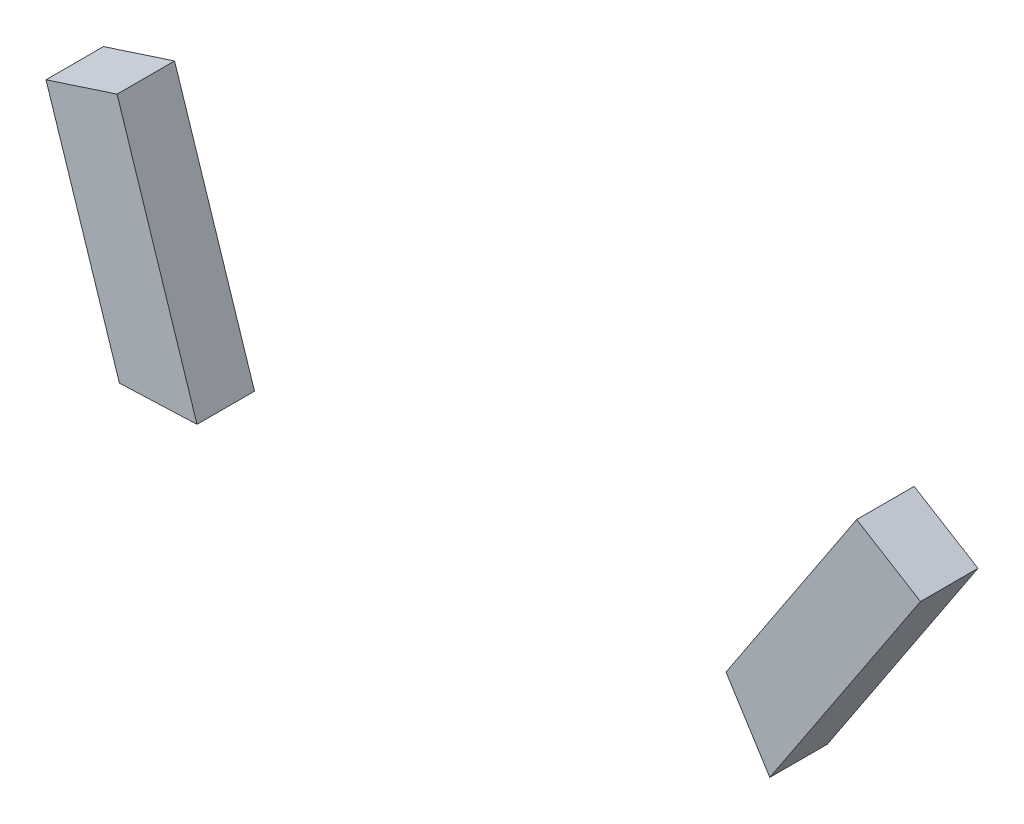
from build123d import *

# Parameters (mm, degrees)
BOSS_EXTRUDE1_DEPTH   = 0.4
BOSS_EXTRUDE1_2_DEPTH = 0.4


with BuildPart() as part:
    # Sketch1 → Boss-Extrude1 (new body)
    with BuildSketch(Plane.XY):
        Polygon((-2.018315316, 3.497446991), (-1.478457585, 3.518691086), (-2.034688175, 5.230592816), (-2.529237563, 5.069903979), align=None)
    extrude(amount=BOSS_EXTRUDE1_DEPTH)


with BuildPart() as body_2:
    # Sketch1 → Boss-Extrude1 2 (new body)
    with BuildSketch(Plane.XY):
        Polygon((3.111517477, 5.240202804), (2.202425017, 3.866713922), (2.507060643, 3.38396102), (3.555740915, 4.968344082), align=None)
    extrude(amount=BOSS_EXTRUDE1_2_DEPTH)


solid = Compound([part.part, body_2.part])
